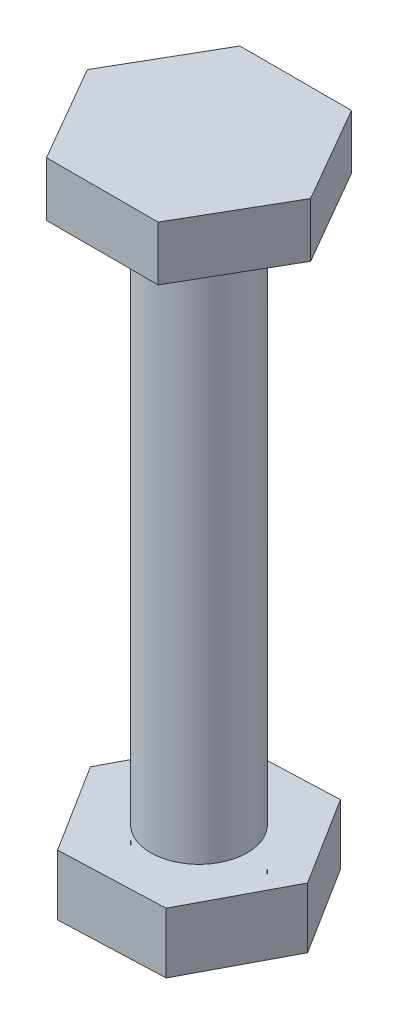
from build123d import *

# Parameters (mm, degrees)
EXTRUDE_1_DEPTH = 4.5
SKETCH_2_R      = 4
EXTRUDE_2_DEPTH = 50
EXTRUDE_3_DEPTH = 5


with BuildPart() as part:
    # 草图1 → 凸台-拉伸1 (new body)
    with BuildSketch(Plane(origin=(0, 0, 0), x_dir=(1, 0, 0), z_dir=(0, 1, 0))):
        Polygon((-12.864054172, 0), (-17.482856325, 8), (-26.720460632, 8), (-31.339262786, 0), (-26.720460632, -8), (-17.482856325, -8), align=None)
    extrude(amount=EXTRUDE_1_DEPTH)

    # 草图2 → 凸台-拉伸2 (add)
    with BuildSketch(Plane.XZ):
        with Locations(Location((-22.101658479, 0, 0), (0, 0, 90))):
            Circle(SKETCH_2_R)
    extrude(amount=EXTRUDE_2_DEPTH)


with BuildPart() as body_2:
    # 草图3 → 凸台-拉伸3 (new body)
    with BuildSketch(Plane.XZ.offset(50)):
        Polygon((-13.447703682, -0.330251979), (-17.488674477, 7.329418708), (-26.142629274, 7.659670687), (-30.755613276, 0.330251979), (-26.714642481, -7.329418708), (-18.060687684, -7.659670687), align=None)
    extrude(amount=-EXTRUDE_3_DEPTH)


solid = Compound([part.part, body_2.part])
